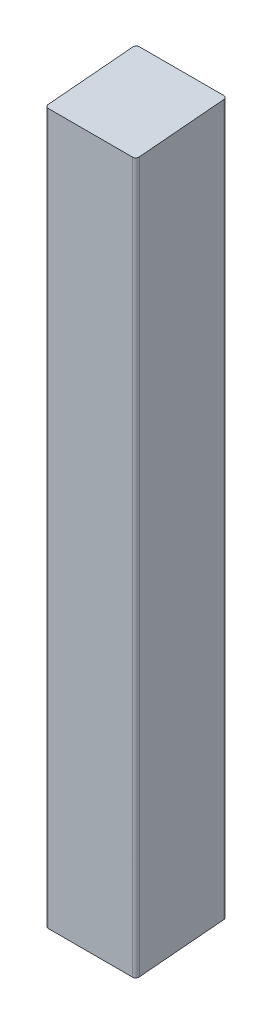
from build123d import *

# Parameters (mm, degrees)
BOSS_EXTRUDE1_DEPTH = 44.45
FILLET1_R           = 3.175


with BuildPart() as part:
    # Sketch1 → Boss-Extrude1 (new, symmetric)
    with BuildSketch(Plane(origin=(0, 0, 0), x_dir=(0, 0, -1), z_dir=(1, 0, 0))):
        Polygon((0, 0), (0, 693.7375), (88.9, 701.515242187), (88.9, 7.777742187), align=None)
    extrude(amount=BOSS_EXTRUDE1_DEPTH, both=True)

    # Fillet1
    fillet1_edges = [part.edges().sort_by_distance(p)[0] for p in [
        (44.45, 346.86875, 0),
        (-44.45, 346.86875, 0),
        (-44.45, 354.646492187, -88.9),
        (44.45, 354.646492187, -88.9),
    ]]
    fillet(fillet1_edges, radius=FILLET1_R)


solid = part.part
